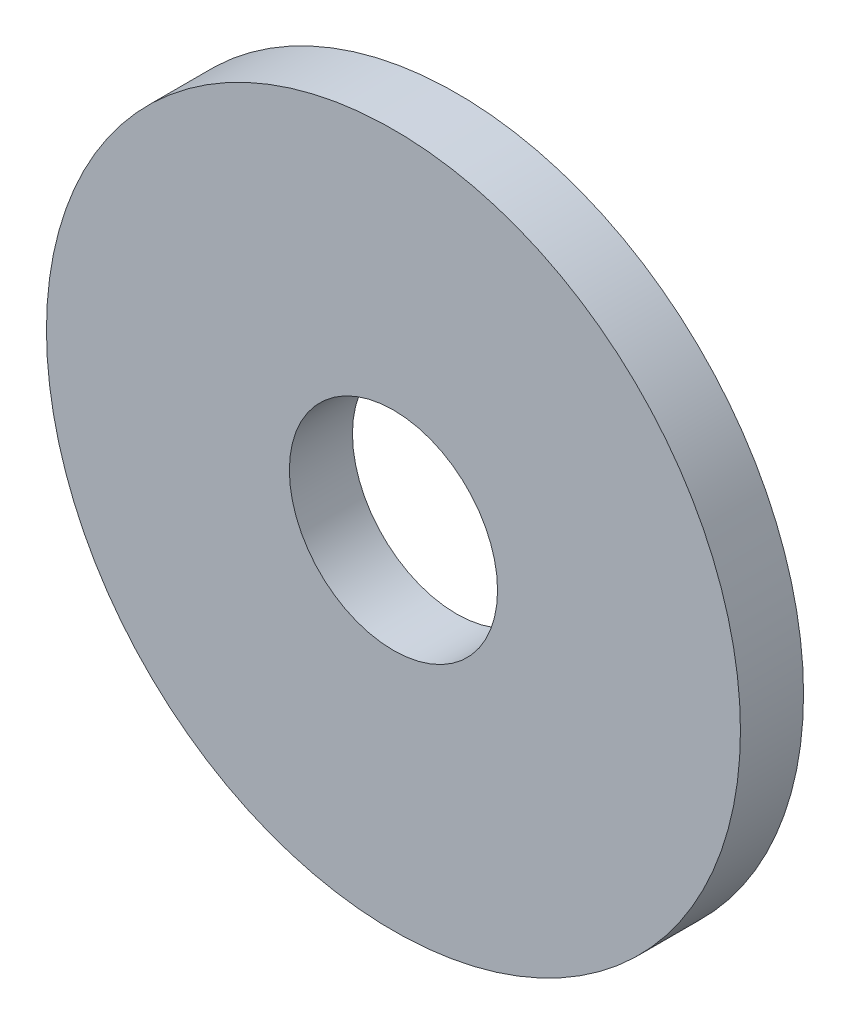
from build123d import *

# Parameters (mm, degrees)
SKETCH3_R           = 11
SKETCH3_R_2         = 3.3
BOSS_EXTRUDE1_DEPTH = 1


with BuildPart() as part:
    # Sketch3 → Boss-Extrude1 (new, symmetric)
    with BuildSketch(Plane.XY):
        Circle(SKETCH3_R)
        Circle(SKETCH3_R_2, mode=Mode.SUBTRACT)
    extrude(amount=BOSS_EXTRUDE1_DEPTH, both=True)


solid = part.part
